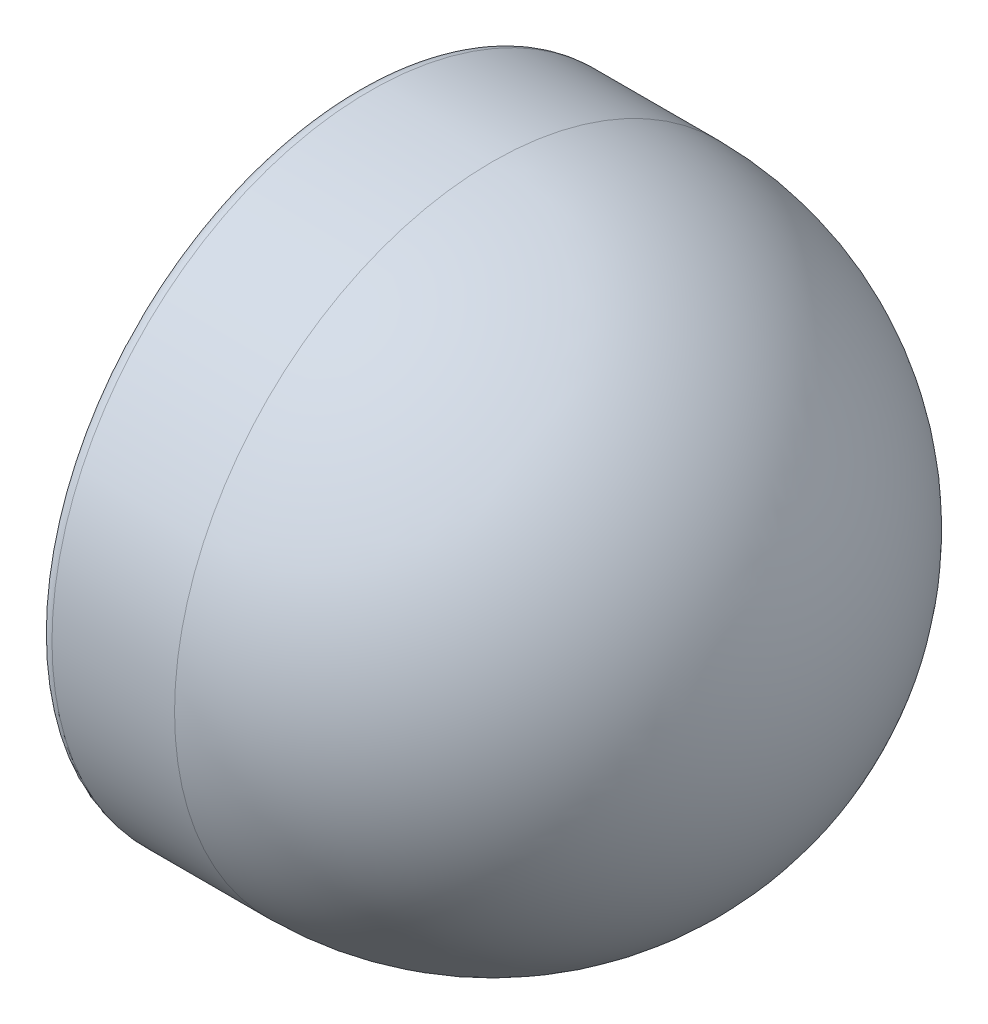
from build123d import *


with BuildPart() as part:
    # Szkic1 → Obrót1 (revolve)
    with BuildSketch(Plane.XY, mode=Mode.PRIVATE) as obr_t1_sk:
        with BuildLine():
            Line((-70, 70), (-97, 70))
            ThreePointArc((-97, 70), (-99.121320344, 69.121320344), (-100, 67))
            Line((-100, 67), (-100, 61.5))
            ThreePointArc((-100, 61.5), (-99.560660172, 60.439339828), (-98.5, 60))
            Line((-98.5, 60), (-96.621320344, 60))
            ThreePointArc((-96.621320344, 60), (-96.047295195, 60.114180701), (-95.560660172, 60.439339828))
            Line((-95.560660172, 60.439339828), (-92, 64))
            Line((-92, 64), (-92, 64.707106781))
            Line((-92, 64.707106781), (-92.707106781, 64.707106781))
            Line((-92.707106781, 64.707106781), (-96.267766953, 61.146446609))
            ThreePointArc((-96.267766953, 61.146446609), (-96.429978627, 61.038060234), (-96.621320344, 61))
            Line((-96.621320344, 61), (-98.5, 61))
            ThreePointArc((-98.5, 61), (-98.853553391, 61.146446609), (-99, 61.5))
            Line((-99, 61.5), (-99, 67))
            ThreePointArc((-99, 67), (-98.414213562, 68.414213562), (-97, 69))
            Line((-97, 69), (-70, 69))
            ThreePointArc((-70, 69), (-21.209632098, 48.790367902), (-1, 0))
            Line((-1, 0), (0, 0))
            ThreePointArc((0, 0), (-20.502525317, 49.497474683), (-70, 70))
        make_face()
    revolve(obr_t1_sk.sketch.rotate(Axis((-70, 0, 0), (1, 0, 0)), 90), axis=Axis((-70, 0, 0), (1, 0, 0)))


solid = part.part
